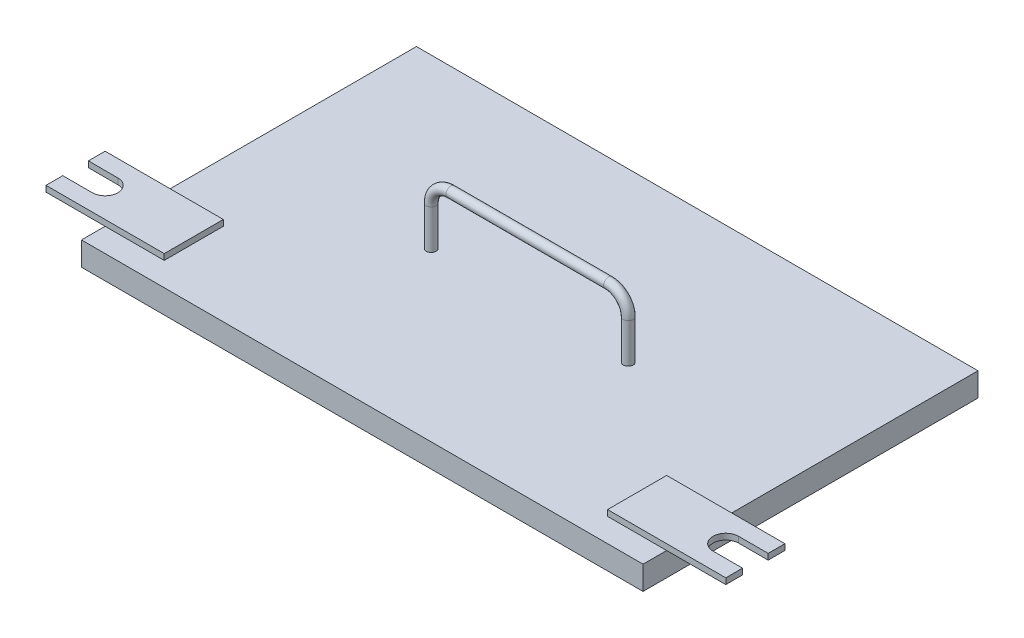
from build123d import *

# Parameters (mm, degrees)
SKETCH1_W           = 285
SKETCH1_H           = 170
BOSS_EXTRUDE1_DEPTH = 12
SKETCH2_R           = 2.5
SKETCH4_W           = 60
SKETCH4_H           = 30
BOSS_EXTRUDE2_DEPTH = 3
CUT_EXTRUDE1_DEPTH  = 195.554619595


with BuildPart() as part:
    # Sketch1 → Boss-Extrude1 (new body)
    with BuildSketch(Plane(origin=(0, 0, 0), x_dir=(1, 0, 0), z_dir=(0, 1, 0))):
        Rectangle(SKETCH1_W, SKETCH1_H)
    extrude(amount=BOSS_EXTRUDE1_DEPTH)

    # Sweep1: sweep along a path in Sketch3
    with BuildLine(Plane.XY) as sweep1_path:
        Line((-50, 12), (-50, 32))
        ThreePointArc((-50, 32), (-47.071067812, 39.071067812), (-40, 42))
        Line((-40, 42), (40, 42))
        ThreePointArc((40, 42), (47.071067812, 39.071067812), (50, 32))
        Line((50, 32), (50, 12))
    # Sketch2 → Sweep1 (sweep)
    with BuildSketch(Plane(origin=(0, 12, 0), x_dir=(1, 0, 0), z_dir=(0, 1, 0))):
        with Locations((-50, 0)):
            Circle(SKETCH2_R)
    sweep(path=sweep1_path.line)

    # Sketch4 → Boss-Extrude2 (add)
    with BuildSketch(Plane(origin=(0, 12, 0), x_dir=(1, 0, 0), z_dir=(0, 1, 0))):
        with Locations((142.5, -58)):
            Rectangle(SKETCH4_W, SKETCH4_H)
        with Locations((-142.5, -58)):
            Rectangle(SKETCH4_W, SKETCH4_H)
    extrude(amount=BOSS_EXTRUDE2_DEPTH)

    # Sketch5 → Cut-Extrude1 (cut, symmetric)
    with BuildSketch(Plane(origin=(0, 15, 0), x_dir=(1, 0, 0), z_dir=(0, 1, 0))):
        with BuildLine():
            Line((157.5, -64.5), (172.5, -64.5))
            Line((172.5, -64.5), (172.5, -51.5))
            Line((172.5, -51.5), (157.5, -51.5))
            ThreePointArc((157.5, -51.5), (151, -58), (157.5, -64.5))
        make_face()
    cut_extrude1 = extrude(amount=CUT_EXTRUDE1_DEPTH, both=True, mode=Mode.SUBTRACT)

    # Mirror1: Cut-Extrude1 across plane
    add(cut_extrude1.mirror(Plane(origin=(0, 0, 0), x_dir=(0, 0, 1), z_dir=(1, 0, 0))), mode=Mode.SUBTRACT)


solid = part.part
